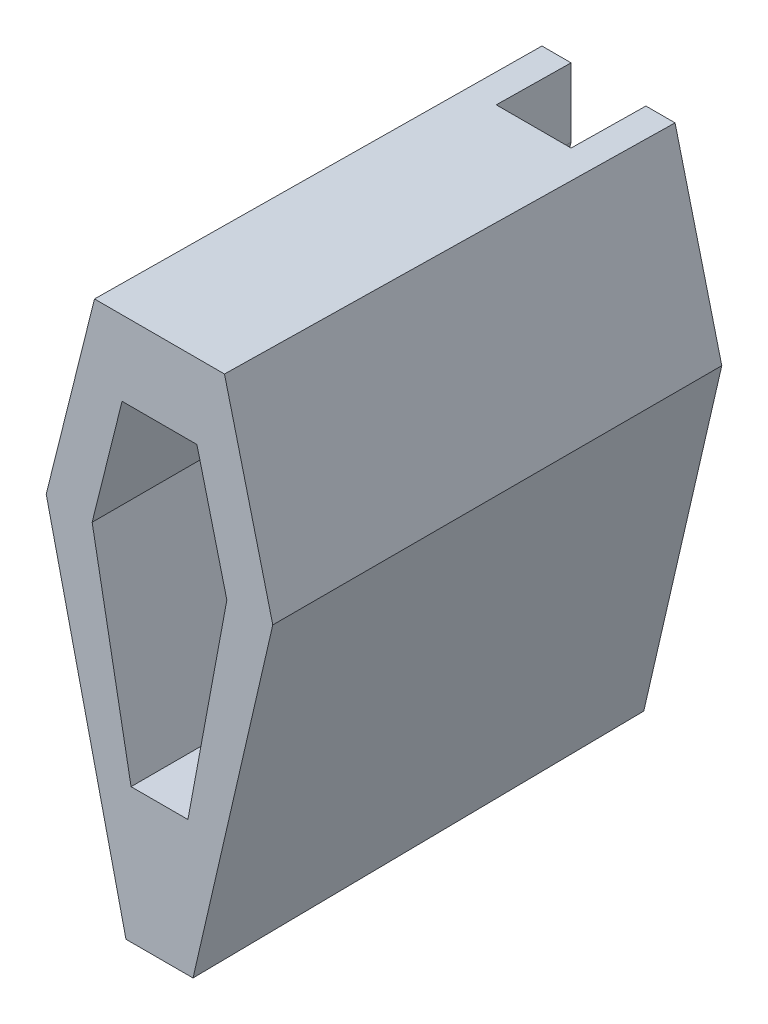
from build123d import *

# Parameters (mm, degrees)
CUT_EXTRUDE_1_DEPTH = 40.276397034
SKETCH_5_W          = 5
SKETCH_5_H          = 6.5
CUT_EXTRUDE_2_DEPTH = 5


with BuildPart() as part:
    # 스케치3 → 로프트1 section 0
    with BuildSketch(Plane.XY):
        with BuildLine():
            Line((-4.446445939, 11.389549668), (4.446445939, 11.389549668))
            Line((4.446445939, 11.389549668), (7.568785652, -1.099809185))
            Line((7.568785652, -1.099809185), (2.355626001, -23.693983454))
            Line((2.355626001, -23.693983454), (-2.355626001, -23.693983454))
            Line((-2.355626001, -23.693983454), (-7.568785652, -1.099809185))
            Line((-7.568785652, -1.099809185), (-4.446445939, 11.389549668))
        make_face()
    # 스케치4 → 로프트1 section 1
    with BuildSketch(Plane.XY.offset(30)):
        with BuildLine():
            Line((-4.342329219, 11.806016546), (4.342329219, 11.806016546))
            Line((4.342329219, 11.806016546), (7.568785652, -1.099809185))
            Line((7.568785652, -1.099809185), (2.240260872, -24.193983454))
            Line((2.240260872, -24.193983454), (-2.240260872, -24.193983454))
            Line((-2.240260872, -24.193983454), (-7.568785652, -1.099809185))
            Line((-7.568785652, -1.099809185), (-4.342329219, 11.806016546))
        make_face()
    loft()

    # 스케치1 → 컷-돌출1 (cut, through all)
    with BuildSketch(Plane.XY):
        Polygon((2.5, 6.806016546), (-2.5, 6.806016546), (-4.5, -1.193983454), (-1.9, -15.193983454), (1.9, -15.193983454), (4.5, -1.193983454), align=None)
    extrude(amount=CUT_EXTRUDE_1_DEPTH, mode=Mode.SUBTRACT)

    # 스케치5 → 컷-돌출2 (cut)
    with BuildSketch(Plane(origin=(0, 0, 0), x_dir=(-1, 0, 0), z_dir=(0, 0, -1))):
        with Locations((0, 10.056016546)):
            Rectangle(SKETCH_5_W, SKETCH_5_H)
    extrude(amount=-CUT_EXTRUDE_2_DEPTH, mode=Mode.SUBTRACT)


solid = part.part
